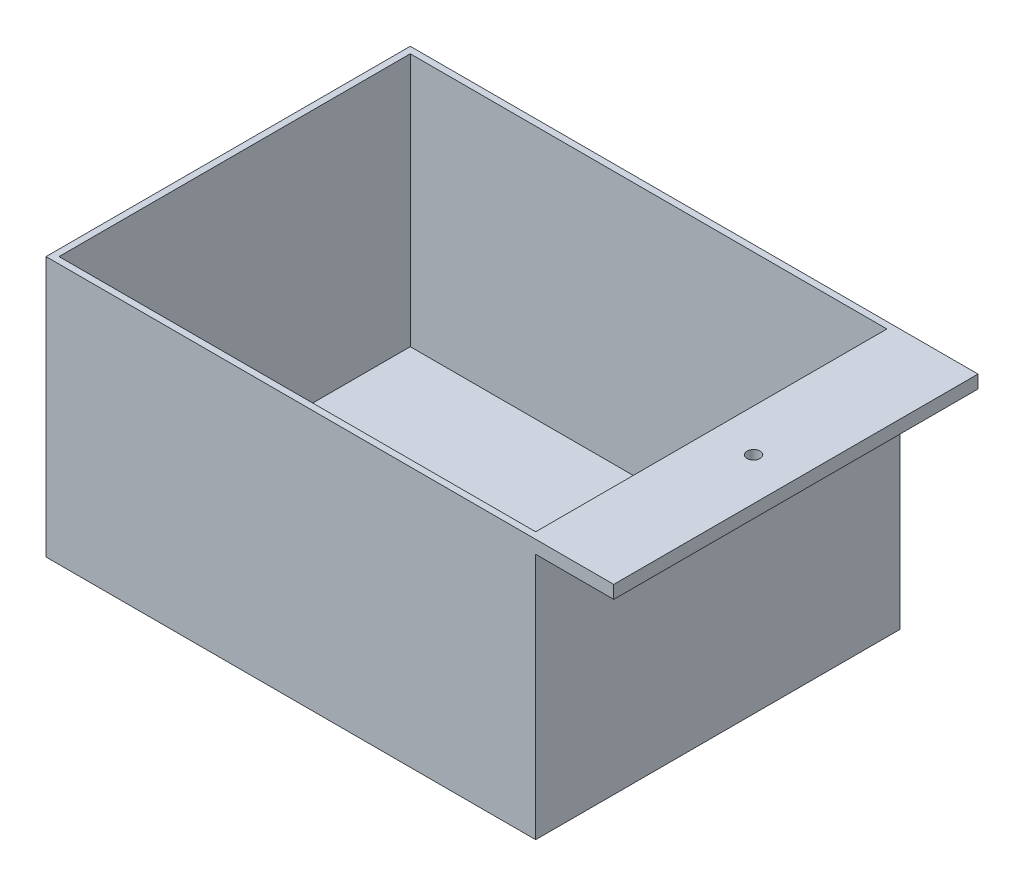
from build123d import *

# Parameters (mm, degrees)
SKETCH1_W           = 239.014
SKETCH1_H           = 177.8
BOSS_EXTRUDE1_DEPTH = 127
SKETCH2_W           = 232.664
SKETCH2_H           = 171.45
CUT_EXTRUDE1_DEPTH  = 123.825
SKETCH3_W           = 177.8
SKETCH3_H           = 6.35
BOSS_EXTRUDE2_DEPTH = 38.1
SKETCH5_R           = 3.175
CUT_EXTRUDE2_DEPTH  = 6.35


with BuildPart() as part:
    # Sketch1 → Boss-Extrude1 (new body)
    with BuildSketch(Plane(origin=(0, 0, 0), x_dir=(1, 0, 0), z_dir=(0, 1, 0))):
        Rectangle(SKETCH1_W, SKETCH1_H)
    extrude(amount=BOSS_EXTRUDE1_DEPTH)

    # Sketch2 → Cut-Extrude1 (cut)
    with BuildSketch(Plane(origin=(0, 127, 0), x_dir=(1, 0, 0), z_dir=(0, 1, 0))):
        Rectangle(SKETCH2_W, SKETCH2_H)
    extrude(amount=-CUT_EXTRUDE1_DEPTH, mode=Mode.SUBTRACT)

    # Sketch3 → Boss-Extrude2 (add)
    with BuildSketch(Plane(origin=(119.507, 0, 0), x_dir=(0, 0, -1), z_dir=(1, 0, 0))):
        with Locations((0, 123.825)):
            Rectangle(SKETCH3_W, SKETCH3_H)
    extrude(amount=BOSS_EXTRUDE2_DEPTH)

    # Sketch5 → Cut-Extrude2 (cut)
    with BuildSketch(Plane(origin=(0, 127, 0), x_dir=(1, 0, 0), z_dir=(0, 1, 0))):
        with Locations(Location((136.9695, 0, 0), (0, 0, 270))):
            Circle(SKETCH5_R)
    extrude(amount=-CUT_EXTRUDE2_DEPTH, mode=Mode.SUBTRACT)


solid = part.part
